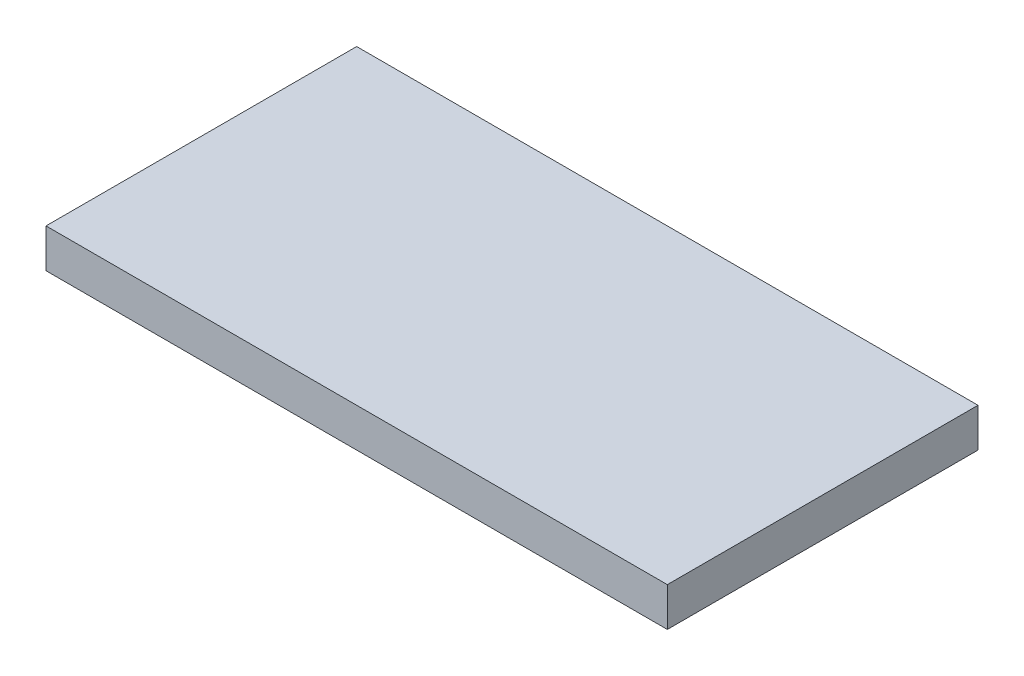
from build123d import *

# Parameters (mm, degrees)
CROQUIS1_W              = 160
CROQUIS1_H              = 80
SALIENTE_EXTRUIR1_DEPTH = 10


with BuildPart() as part:
    # Croquis1 → Saliente-Extruir1 (new body)
    with BuildSketch(Plane(origin=(0, 0, 0), x_dir=(1, 0, 0), z_dir=(0, 1, 0))):
        Rectangle(CROQUIS1_W, CROQUIS1_H)
    extrude(amount=SALIENTE_EXTRUIR1_DEPTH)


solid = part.part
